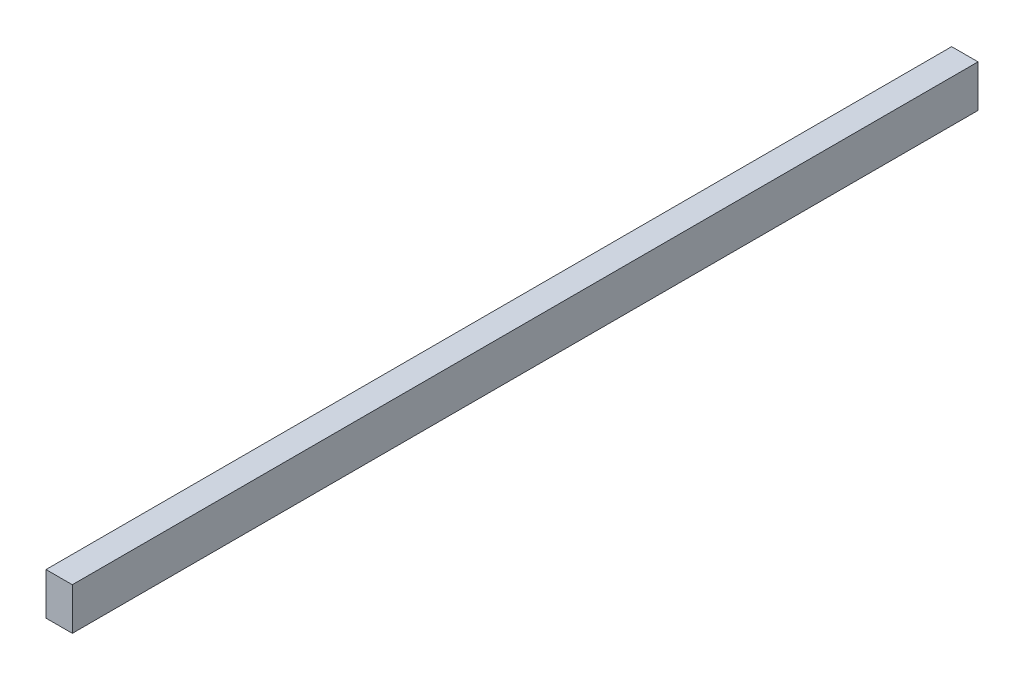
from build123d import *

# Parameters (mm, degrees)
CROQUIS_TRAVESANO_W   = 25
CROQUIS_TRAVESANO_H   = 860
TRAVESANO_CORTO_DEPTH = 40


with BuildPart() as part:
    # Croquis_travesano → Travesano_corto (new body)
    with BuildSketch(Plane(origin=(0, 0, 0), x_dir=(1, 0, 0), z_dir=(0, 1, 0))):
        Rectangle(CROQUIS_TRAVESANO_W, CROQUIS_TRAVESANO_H)
    extrude(amount=TRAVESANO_CORTO_DEPTH)


solid = part.part
